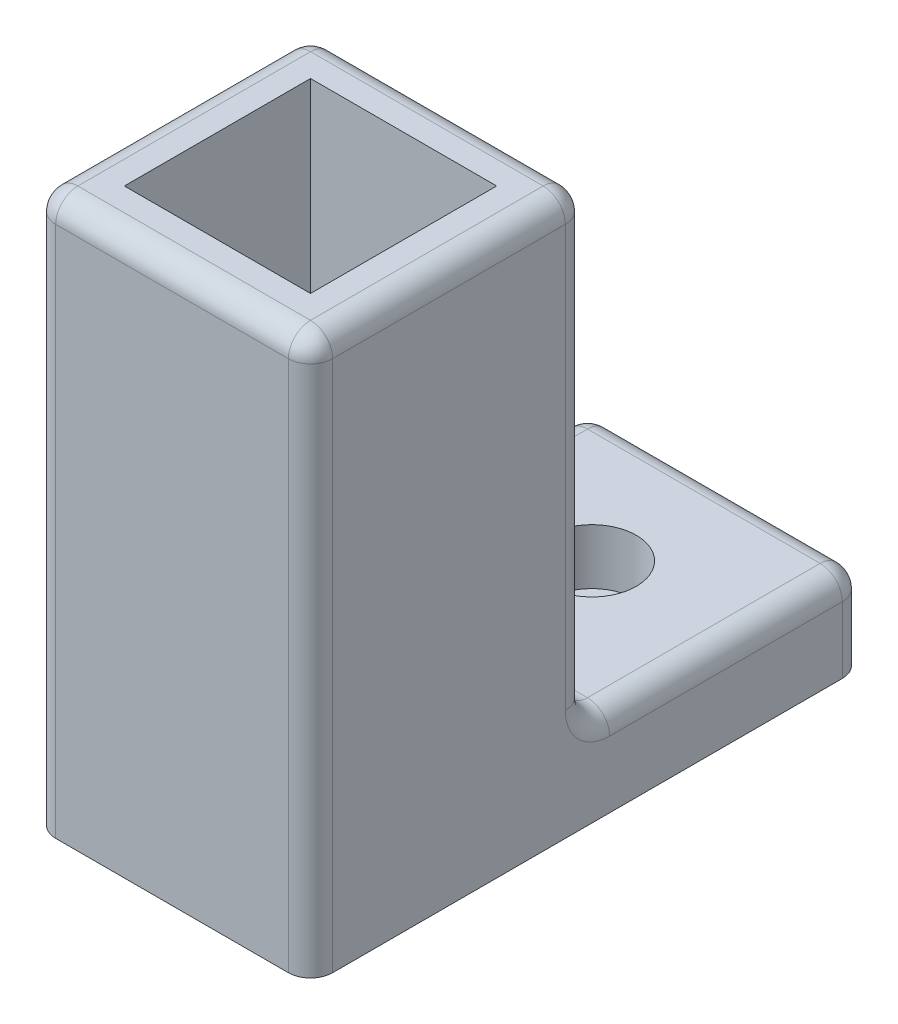
from build123d import *

# Parameters (mm, degrees)
SKETCH1_W               = 25
SKETCH1_H               = 25
SKETCH1_W_2             = 16.8
SKETCH1_H_2             = 16.8
BOSS_EXTRUDE1_DEPTH     = 50
SKETCH6_W               = 25
SKETCH6_H               = 50
BOSS_EXTRUDE3_DEPTH     = 8
FILLET2_R               = 2
SKETCH7_R               = 4
CUT_EXTRUDE1_DEPTH      = 5
CUT_EXTRUDE4_DEPTH      = 64.73774392
CUT_EXTRUDE4_DEPTH_BACK = 64.73774392
SKETCH8_R               = 2.38125


with BuildPart() as part:
    # Sketch1 → Boss-Extrude1 (new body)
    with BuildSketch(Plane(origin=(0, 0, 0), x_dir=(1, 0, 0), z_dir=(0, 1, 0))):
        Rectangle(SKETCH1_W, SKETCH1_H)
        Rectangle(SKETCH1_W_2, SKETCH1_H_2, mode=Mode.SUBTRACT)
    extrude(amount=BOSS_EXTRUDE1_DEPTH)

    # Sketch6 → Boss-Extrude3 (add)
    with BuildSketch(Plane(origin=(0, 0, 0), x_dir=(1, 0, 0), z_dir=(0, 1, 0))):
        with Locations((0, 12.5)):
            Rectangle(SKETCH6_W, SKETCH6_H)
    extrude(amount=BOSS_EXTRUDE3_DEPTH)

    # Fillet2
    fillet2_edges = [part.edges().sort_by_distance(p)[0] for p in [
        (-12.5, 50, 0),
        (0, 50, 12.5),
        (-12.5, 4, -37.5),
        (-12.5, 8, -25),
        (0, 8, -12.5),
        (12.5, 8, -25),
        (0, 8, -37.5),
        (12.5, 4, -37.5),
        (12.5, 50, 0),
        (12.5, 25, 12.5),
        (-12.5, 25, 12.5),
        (-12.5, 29, -12.5),
        (12.5, 29, -12.5),
        (0, 50, -12.5),
    ]]
    fillet(fillet2_edges, radius=FILLET2_R)

    # Sketch7 → Cut-Extrude1 (cut)
    with BuildSketch(Plane(origin=(0, 8, 0), x_dir=(1, 0, 0), z_dir=(0, 1, 0))):
        with Locations(Location((0, 0, 0), (0, 0, 270))):
            Circle(SKETCH7_R)
        with Locations(Location((0, 25.4, 0), (0, 0, 270))):
            Circle(SKETCH7_R)
    extrude(amount=-CUT_EXTRUDE1_DEPTH, mode=Mode.SUBTRACT)

    # Sketch8 → Cut-Extrude4 (cut, two sides: drawn at the far end of the back side and taken through both)
    with BuildSketch(Plane(origin=(0, 0, 0), x_dir=(1, 0, 0), z_dir=(0, 1, 0)).offset(-CUT_EXTRUDE4_DEPTH_BACK)):
        with Locations(Location((0, 0, 0), (0, 0, 270))):
            Circle(SKETCH8_R)
        with Locations(Location((0, 25.4, 0), (0, 0, 270))):
            Circle(SKETCH8_R)
    extrude(amount=CUT_EXTRUDE4_DEPTH + CUT_EXTRUDE4_DEPTH_BACK, mode=Mode.SUBTRACT)


solid = part.part
